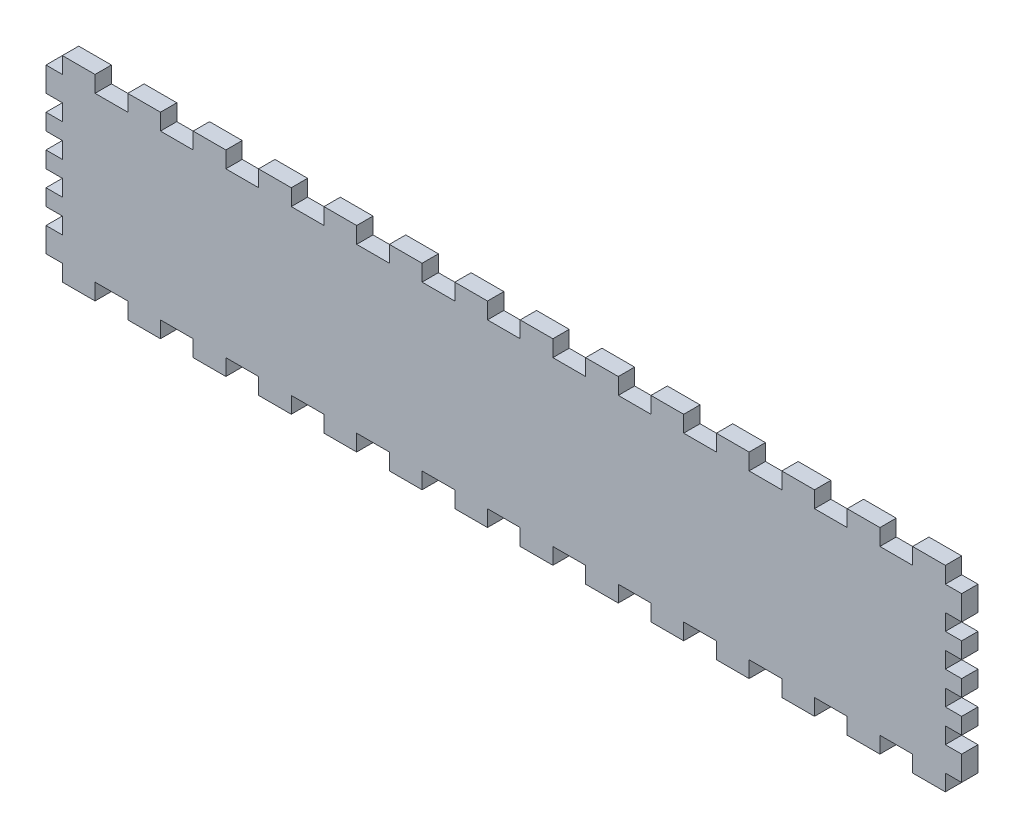
from build123d import *

# Parameters (mm, degrees)
SKETCH1_W                = 355.6
SKETCH1_H                = 76.2
BOSS_EXTRUDE1_DEPTH      = 6.35
SKETCH2_W                = 12.7
SKETCH2_H                = 25.4
CUT_EXTRUDE5_DEPTH       = 182.94716953
LPATTERN1_COUNT          = 13
LPATTERN1_PITCH          = 25.4
MIRROR1_COPY_1_SKETCH_W  = 12.7
MIRROR1_COPY_1_SKETCH_H  = 25.4
MIRROR1_COPY_1_DEPTH     = 182.94716953
MIRROR1_COPY_2_SKETCH_W  = 12.7
MIRROR1_COPY_2_SKETCH_H  = 25.4
MIRROR1_COPY_2_DEPTH     = 182.94716953
MIRROR1_COPY_3_SKETCH_W  = 12.7
MIRROR1_COPY_3_SKETCH_H  = 25.4
MIRROR1_COPY_3_DEPTH     = 182.94716953
MIRROR1_COPY_4_SKETCH_W  = 12.7
MIRROR1_COPY_4_SKETCH_H  = 25.4
MIRROR1_COPY_4_DEPTH     = 182.94716953
MIRROR1_COPY_5_SKETCH_W  = 12.7
MIRROR1_COPY_5_SKETCH_H  = 25.4
MIRROR1_COPY_5_DEPTH     = 182.94716953
MIRROR1_COPY_6_SKETCH_W  = 12.7
MIRROR1_COPY_6_SKETCH_H  = 25.4
MIRROR1_COPY_6_DEPTH     = 182.94716953
MIRROR1_COPY_7_SKETCH_W  = 12.7
MIRROR1_COPY_7_SKETCH_H  = 25.4
MIRROR1_COPY_7_DEPTH     = 182.94716953
MIRROR1_COPY_8_SKETCH_W  = 12.7
MIRROR1_COPY_8_SKETCH_H  = 25.4
MIRROR1_COPY_8_DEPTH     = 182.94716953
MIRROR1_COPY_9_SKETCH_W  = 12.7
MIRROR1_COPY_9_SKETCH_H  = 25.4
MIRROR1_COPY_9_DEPTH     = 182.94716953
MIRROR1_COPY_10_SKETCH_W = 12.7
MIRROR1_COPY_10_SKETCH_H = 25.4
MIRROR1_COPY_10_DEPTH    = 182.94716953
MIRROR1_COPY_11_SKETCH_W = 12.7
MIRROR1_COPY_11_SKETCH_H = 25.4
MIRROR1_COPY_11_DEPTH    = 182.94716953
MIRROR1_COPY_12_SKETCH_W = 12.7
MIRROR1_COPY_12_SKETCH_H = 25.4
MIRROR1_COPY_12_DEPTH    = 182.94716953
SKETCH3_W                = 40.748476415
SKETCH3_H                = 6.35
SKETCH3_W_2              = 25.4
SKETCH3_H_2              = 25.4
CUT_EXTRUDE7_DEPTH       = 182.94716953


with BuildPart() as part:
    # Sketch1 → Boss-Extrude1 (new body)
    with BuildSketch(Plane.XY):
        Rectangle(SKETCH1_W, SKETCH1_H)
    extrude(amount=BOSS_EXTRUDE1_DEPTH)

    # Sketch2 → Cut-Extrude5 (cut, symmetric)
    with BuildSketch(Plane.XY):
        with Locations((152.4, -44.45)):
            Rectangle(SKETCH2_W, SKETCH2_H)
    cut_extrude5 = extrude(amount=CUT_EXTRUDE5_DEPTH, both=True, mode=Mode.SUBTRACT)

    # LPattern1: Cut-Extrude5 ×13
    with Locations(*[(-i * LPATTERN1_PITCH, 0, 0) for i in range(1, LPATTERN1_COUNT)]):
        add(cut_extrude5, mode=Mode.SUBTRACT)

    # Mirror1: Cut-Extrude5 across plane
    add(cut_extrude5.mirror(Plane.ZX), mode=Mode.SUBTRACT)

    # Mirror1 copy 1 sketch → Mirror1 copy 1 (cut, symmetric)
    with BuildSketch(Plane(origin=(-25.4, 0, 0), x_dir=(1, 0, 0), z_dir=(0, 0, 1))):
        with Locations((152.4, 44.45)):
            Rectangle(MIRROR1_COPY_1_SKETCH_W, MIRROR1_COPY_1_SKETCH_H)
    extrude(amount=MIRROR1_COPY_1_DEPTH, both=True, mode=Mode.SUBTRACT)

    # Mirror1 copy 2 sketch → Mirror1 copy 2 (cut, symmetric)
    with BuildSketch(Plane(origin=(-50.8, 0, 0), x_dir=(1, 0, 0), z_dir=(0, 0, 1))):
        with Locations((152.4, 44.45)):
            Rectangle(MIRROR1_COPY_2_SKETCH_W, MIRROR1_COPY_2_SKETCH_H)
    extrude(amount=MIRROR1_COPY_2_DEPTH, both=True, mode=Mode.SUBTRACT)

    # Mirror1 copy 3 sketch → Mirror1 copy 3 (cut, symmetric)
    with BuildSketch(Plane(origin=(-76.2, 0, 0), x_dir=(1, 0, 0), z_dir=(0, 0, 1))):
        with Locations((152.4, 44.45)):
            Rectangle(MIRROR1_COPY_3_SKETCH_W, MIRROR1_COPY_3_SKETCH_H)
    extrude(amount=MIRROR1_COPY_3_DEPTH, both=True, mode=Mode.SUBTRACT)

    # Mirror1 copy 4 sketch → Mirror1 copy 4 (cut, symmetric)
    with BuildSketch(Plane(origin=(-101.6, 0, 0), x_dir=(1, 0, 0), z_dir=(0, 0, 1))):
        with Locations((152.4, 44.45)):
            Rectangle(MIRROR1_COPY_4_SKETCH_W, MIRROR1_COPY_4_SKETCH_H)
    extrude(amount=MIRROR1_COPY_4_DEPTH, both=True, mode=Mode.SUBTRACT)

    # Mirror1 copy 5 sketch → Mirror1 copy 5 (cut, symmetric)
    with BuildSketch(Plane(origin=(-127, 0, 0), x_dir=(1, 0, 0), z_dir=(0, 0, 1))):
        with Locations((152.4, 44.45)):
            Rectangle(MIRROR1_COPY_5_SKETCH_W, MIRROR1_COPY_5_SKETCH_H)
    extrude(amount=MIRROR1_COPY_5_DEPTH, both=True, mode=Mode.SUBTRACT)

    # Mirror1 copy 6 sketch → Mirror1 copy 6 (cut, symmetric)
    with BuildSketch(Plane(origin=(-152.4, 0, 0), x_dir=(1, 0, 0), z_dir=(0, 0, 1))):
        with Locations((152.4, 44.45)):
            Rectangle(MIRROR1_COPY_6_SKETCH_W, MIRROR1_COPY_6_SKETCH_H)
    extrude(amount=MIRROR1_COPY_6_DEPTH, both=True, mode=Mode.SUBTRACT)

    # Mirror1 copy 7 sketch → Mirror1 copy 7 (cut, symmetric)
    with BuildSketch(Plane(origin=(-177.8, 0, 0), x_dir=(1, 0, 0), z_dir=(0, 0, 1))):
        with Locations((152.4, 44.45)):
            Rectangle(MIRROR1_COPY_7_SKETCH_W, MIRROR1_COPY_7_SKETCH_H)
    extrude(amount=MIRROR1_COPY_7_DEPTH, both=True, mode=Mode.SUBTRACT)

    # Mirror1 copy 8 sketch → Mirror1 copy 8 (cut, symmetric)
    with BuildSketch(Plane(origin=(-203.2, 0, 0), x_dir=(1, 0, 0), z_dir=(0, 0, 1))):
        with Locations((152.4, 44.45)):
            Rectangle(MIRROR1_COPY_8_SKETCH_W, MIRROR1_COPY_8_SKETCH_H)
    extrude(amount=MIRROR1_COPY_8_DEPTH, both=True, mode=Mode.SUBTRACT)

    # Mirror1 copy 9 sketch → Mirror1 copy 9 (cut, symmetric)
    with BuildSketch(Plane(origin=(-228.6, 0, 0), x_dir=(1, 0, 0), z_dir=(0, 0, 1))):
        with Locations((152.4, 44.45)):
            Rectangle(MIRROR1_COPY_9_SKETCH_W, MIRROR1_COPY_9_SKETCH_H)
    extrude(amount=MIRROR1_COPY_9_DEPTH, both=True, mode=Mode.SUBTRACT)

    # Mirror1 copy 10 sketch → Mirror1 copy 10 (cut, symmetric)
    with BuildSketch(Plane(origin=(-254, 0, 0), x_dir=(1, 0, 0), z_dir=(0, 0, 1))):
        with Locations((152.4, 44.45)):
            Rectangle(MIRROR1_COPY_10_SKETCH_W, MIRROR1_COPY_10_SKETCH_H)
    extrude(amount=MIRROR1_COPY_10_DEPTH, both=True, mode=Mode.SUBTRACT)

    # Mirror1 copy 11 sketch → Mirror1 copy 11 (cut, symmetric)
    with BuildSketch(Plane(origin=(-279.4, 0, 0), x_dir=(1, 0, 0), z_dir=(0, 0, 1))):
        with Locations((152.4, 44.45)):
            Rectangle(MIRROR1_COPY_11_SKETCH_W, MIRROR1_COPY_11_SKETCH_H)
    extrude(amount=MIRROR1_COPY_11_DEPTH, both=True, mode=Mode.SUBTRACT)

    # Mirror1 copy 12 sketch → Mirror1 copy 12 (cut, symmetric)
    with BuildSketch(Plane(origin=(-304.8, 0, 0), x_dir=(1, 0, 0), z_dir=(0, 0, 1))):
        with Locations((152.4, 44.45)):
            Rectangle(MIRROR1_COPY_12_SKETCH_W, MIRROR1_COPY_12_SKETCH_H)
    extrude(amount=MIRROR1_COPY_12_DEPTH, both=True, mode=Mode.SUBTRACT)

    # Sketch3 → Cut-Extrude7 (cut, through all)
    with BuildSketch(Plane.XY):
        with Locations((191.824238208, 19.05)):
            Rectangle(SKETCH3_W, SKETCH3_H)
        with Locations((191.824238208, 6.35)):
            Rectangle(SKETCH3_W, SKETCH3_H)
        with Locations((191.824238208, -6.35)):
            Rectangle(SKETCH3_W, SKETCH3_H)
        with Locations((191.824238208, -19.05)):
            Rectangle(SKETCH3_W, SKETCH3_H)
        with Locations((184.15, 44.45)):
            Rectangle(SKETCH3_W_2, SKETCH3_H_2)
        with Locations((184.15, -44.45)):
            Rectangle(SKETCH3_W_2, SKETCH3_H_2)
    cut_extrude7 = extrude(amount=CUT_EXTRUDE7_DEPTH, mode=Mode.SUBTRACT)

    # Mirror2: Cut-Extrude7 across plane
    add(cut_extrude7.mirror(Plane(origin=(0, 0, 0), x_dir=(0, 0, 1), z_dir=(1, 0, 0))), mode=Mode.SUBTRACT)


solid = part.part
